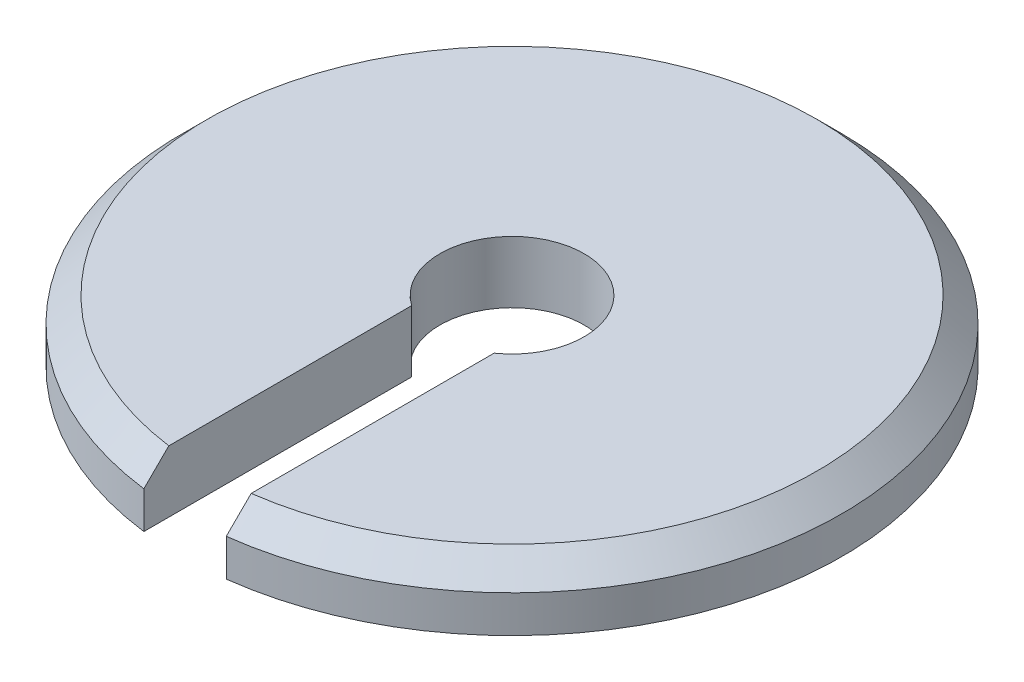
from build123d import *

# Parameters (mm, degrees)
BOSS_EXTRUDE1_DEPTH = 1.905
CHAMFER1_SIZE       = 0.762


with BuildPart() as part:
    # Sketch1 → Boss-Extrude1 (new body)
    with BuildSketch(Plane(origin=(0, 0, 0), x_dir=(1, 0, 0), z_dir=(0, 1, 0))):
        with BuildLine():
            ThreePointArc((10.16, 0), (-6.72020833, 7.62), (-1.27, -10.080312495))
            Line((-1.27, -10.080312495), (-1.27, -1.82389864))
            ThreePointArc((-1.27, -1.82389864), (-1.028817586, 1.970035691), (2.2225, 0))
            ThreePointArc((2.2225, 0), (1.970035691, -1.028817586), (1.27, -1.82389864))
            Line((1.27, -1.82389864), (1.27, -10.080312495))
            ThreePointArc((1.27, -10.080312495), (7.62, -6.72020833), (10.16, 0))
        make_face()
    extrude(amount=BOSS_EXTRUDE1_DEPTH)

    # Chamfer1
    chamfer1_edges = [part.edges().sort_by_distance(p)[0] for p in [
        (0, 1.905, -10.16),
    ]]
    chamfer(chamfer1_edges, length=CHAMFER1_SIZE)


solid = part.part
